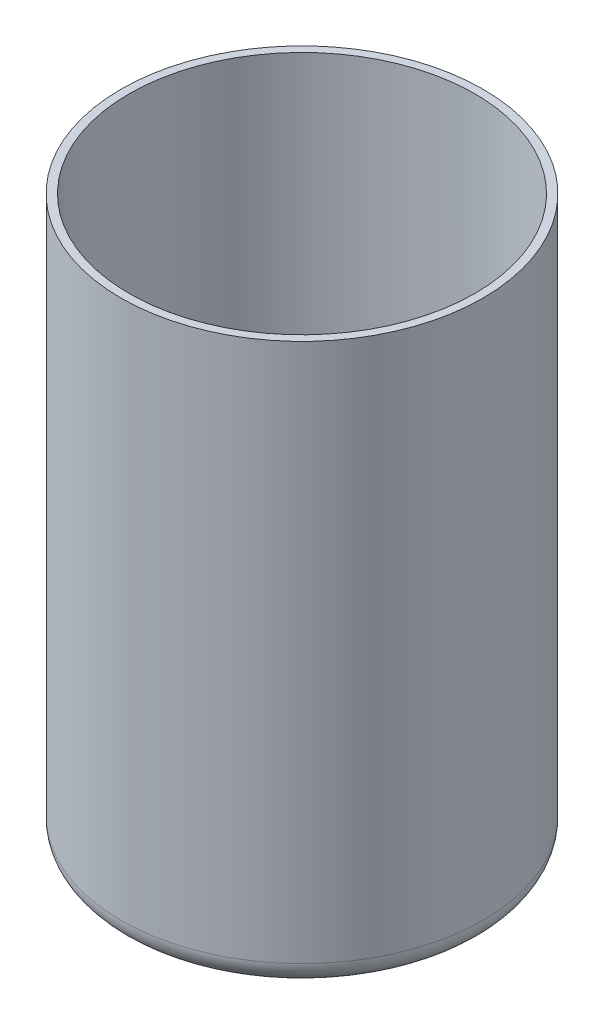
from build123d import *

# Parameters (mm, degrees)
SKETCH1_R           = 22.5
SKETCH1_R_2         = 21.5
EXTRUDE_THIN1_DEPTH = 70
SKETCH1_3_R         = 21.5
BOSS_EXTRUDE1_DEPTH = 1
FILLET1_R           = 3
SKETCH2_R           = 1.5
CUT_EXTRUDE1_DEPTH  = 1


with BuildPart() as part:
    # Sketch1 → Extrude-Thin1 (new body)
    with BuildSketch(Plane(origin=(0, 0, 0), x_dir=(1, 0, 0), z_dir=(0, 1, 0))):
        Circle(SKETCH1_R)
        Circle(SKETCH1_R_2, mode=Mode.SUBTRACT)
    extrude(amount=EXTRUDE_THIN1_DEPTH)

    # Sketch1<3> → Boss-Extrude1 (add)
    with BuildSketch(Plane(origin=(0, 0, 0), x_dir=(1, 0, 0), z_dir=(0, 1, 0))):
        Circle(SKETCH1_3_R)
    extrude(amount=BOSS_EXTRUDE1_DEPTH)

    # Fillet1
    fillet1_edges = [part.edges().sort_by_distance(p)[0] for p in [
        (-22.5, 0, 0),
    ]]
    fillet(fillet1_edges, radius=FILLET1_R)

    # Sketch2 → Cut-Extrude1 (cut)
    with BuildSketch(Plane.XZ):
        with Locations(Location((0, 0, 0), (0, 0, 270))):
            Circle(SKETCH2_R)
    extrude(amount=-CUT_EXTRUDE1_DEPTH, mode=Mode.SUBTRACT)


solid = part.part
